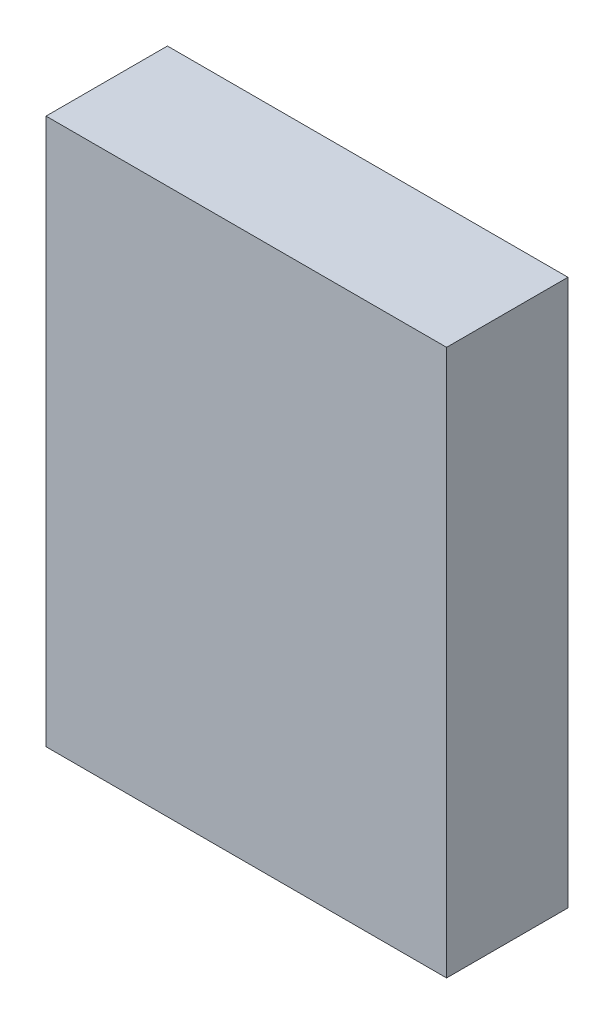
from build123d import *

# Parameters (mm, degrees)
SKETCH1_W           = 660
SKETCH1_H           = 900
BOSS_EXTRUDE1_DEPTH = 200


with BuildPart() as part:
    # Sketch1 → Boss-Extrude1 (new body)
    with BuildSketch(Plane.XY):
        Rectangle(SKETCH1_W, SKETCH1_H)
    extrude(amount=BOSS_EXTRUDE1_DEPTH)


solid = part.part
